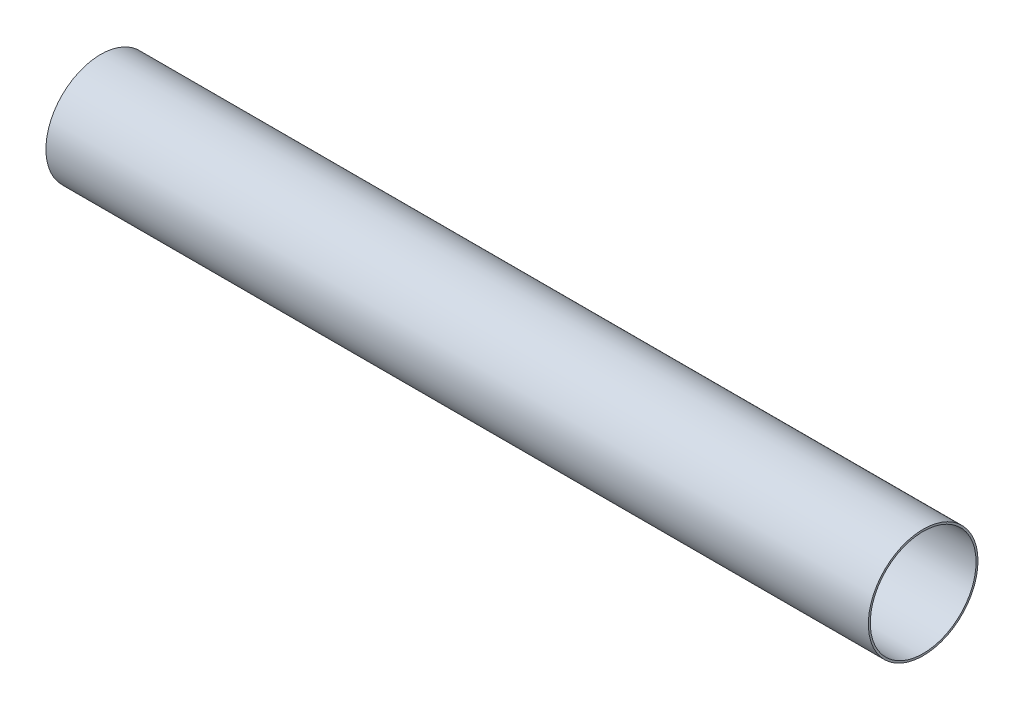
from build123d import *

# Parameters (mm, degrees)
SKETCH1_R           = 50.8
SKETCH1_R_2         = 49.022
BOSS_EXTRUDE1_DEPTH = 762


with BuildPart() as part:
    # Sketch1 → Boss-Extrude1 (new body)
    with BuildSketch(Plane(origin=(0, 0, 0), x_dir=(0, 0, -1), z_dir=(1, 0, 0))):
        Circle(SKETCH1_R)
        Circle(SKETCH1_R_2, mode=Mode.SUBTRACT)
    extrude(amount=BOSS_EXTRUDE1_DEPTH)


solid = part.part
